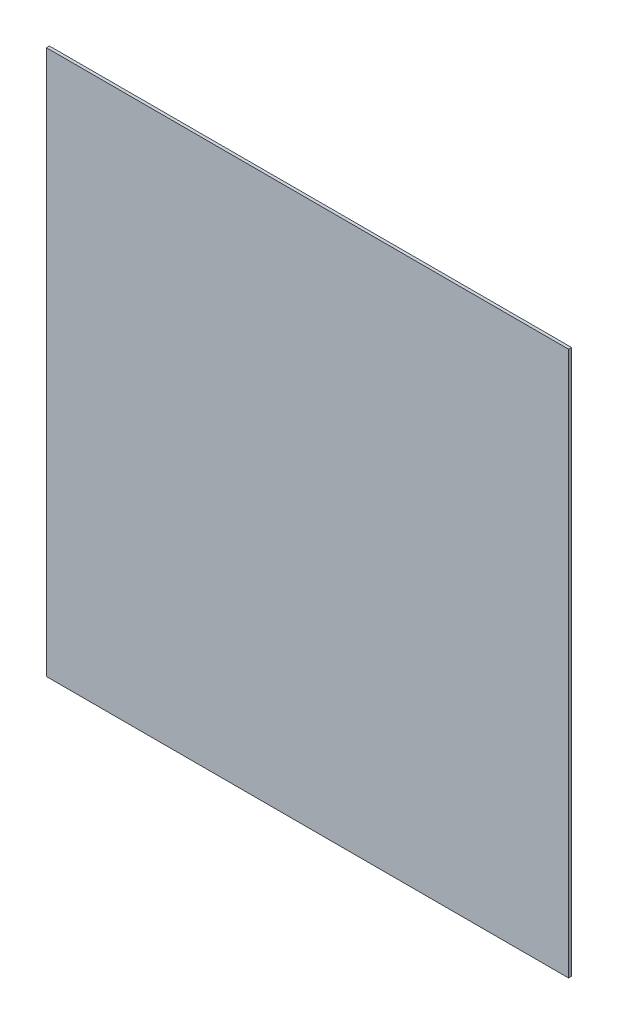
from build123d import *

# Parameters (mm, degrees)
SKETCH1_W           = 872.5
SKETCH1_H           = 910
BOSS_EXTRUDE1_DEPTH = 5


with BuildPart() as part:
    # Sketch1 → Boss-Extrude1 (new body)
    with BuildSketch(Plane.XY):
        Rectangle(SKETCH1_W, SKETCH1_H)
    extrude(amount=BOSS_EXTRUDE1_DEPTH)


solid = part.part
